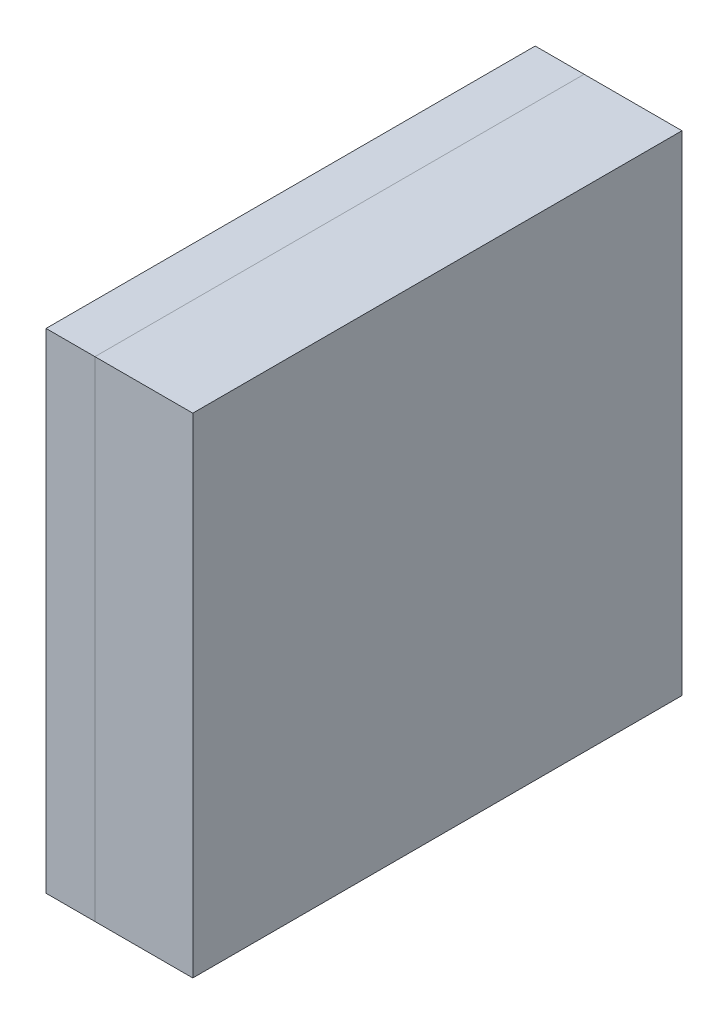
from build123d import *

# Parameters (mm, degrees)
SKETCH1_W           = 1000
SKETCH1_H           = 1000
BOSS_EXTRUDE1_DEPTH = 100
SKETCH2_W           = 1000
SKETCH2_H           = 1000
BOSS_EXTRUDE2_DEPTH = 200


with BuildPart() as part:
    # Sketch1 → Boss-Extrude1 (new body)
    with BuildSketch(Plane(origin=(0, 0, 0), x_dir=(0, 0, -1), z_dir=(1, 0, 0))):
        Rectangle(SKETCH1_W, SKETCH1_H)
    extrude(amount=BOSS_EXTRUDE1_DEPTH)


with BuildPart() as body_2:
    # Sketch2 → Boss-Extrude2 (new body)
    with BuildSketch(Plane(origin=(100, 0, 0), x_dir=(0, 0, -1), z_dir=(1, 0, 0))):
        Rectangle(SKETCH2_W, SKETCH2_H)
    extrude(amount=BOSS_EXTRUDE2_DEPTH)


solid = Compound([part.part, body_2.part])
